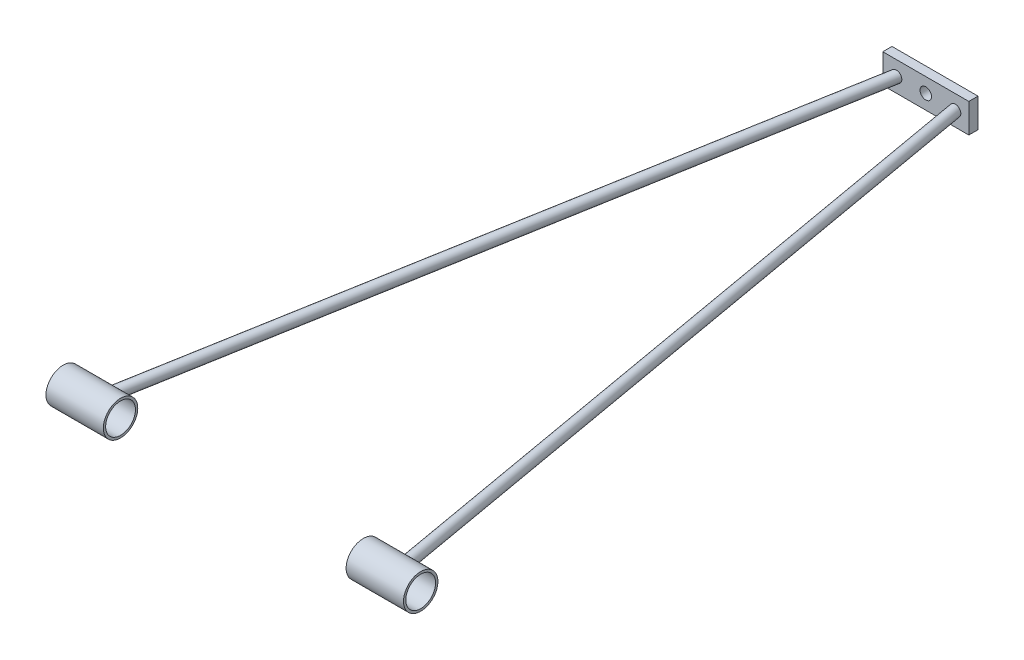
from build123d import *

# Parameters (mm, degrees)
SWEEP2_PROFILE_R        = 4.7625
SWEEP3_PROFILE_R        = 4.7625
SWEEP_THIN2_PROFILE_R   = 15
SWEEP_THIN2_PROFILE_R_2 = 13
SWEEP_THIN3_PROFILE_R   = 15
SWEEP_THIN3_PROFILE_R_2 = 13
BOSS_EXTRUDE1_DEPTH     = 12.7
SKETCH164_W             = 8
SKETCH164_H             = 25.4
CUT_EXTRUDE1_DEPTH      = 635.353542167
SKETCH165_R             = 15
CUT_EXTRUDE2_DEPTH      = 680.802036854
SKETCH166_R             = 5
CUT_EXTRUDE3_DEPTH      = 25.4


with BuildPart() as part:
    # Sweep2: sweep along a path in Sketch1
    with BuildLine(Plane(origin=(0, 0, 0), x_dir=(1, 0, 0), z_dir=(0, 1, 0))) as sweep2_path:
        Line((130.796188425, 0), (25, 600))
    # Sweep2 profile (on start of the path) → Sweep2 (sweep)
    with BuildSketch(Plane(origin=(130.796188425, 0, 0), x_dir=(-0.9848077530122079, 0, 0.17364817766693125), z_dir=(-0.17364817766693125, 0, -0.9848077530122079))):
        Circle(SWEEP2_PROFILE_R)
    sweep(path=sweep2_path.line)


with BuildPart() as body_2:
    # Sweep3: sweep along a path in Sketch78
    with BuildLine(Plane(origin=(0, 0, 0), x_dir=(1, 0, 0), z_dir=(0, 1, 0))) as sweep3_path:
        Line((-130.796188425, 0), (-25, 600))
    # Sweep3 profile (on start of the path) → Sweep3 (sweep)
    with BuildSketch(Plane(origin=(-130.796188425, 0, 0), x_dir=(-0.9848077530122079, 0, -0.17364817766693125), z_dir=(0.17364817766693125, 0, -0.9848077530122079))):
        Circle(SWEEP3_PROFILE_R)
    sweep(path=sweep3_path.line)


with BuildPart() as body_3:
    # Sweep-Thin2: sweep along a path in Sketch87
    with BuildLine(Plane(origin=(0, 0, 0), x_dir=(1, 0, 0), z_dir=(0, 1, 0))) as sweep_thin2_path:
        Line((-155.796188425, 0), (-105.796188425, 0))
    # Sweep-Thin2 profile (on start of the path) → Sweep-Thin2 (sweep)
    with BuildSketch(Plane(origin=(-155.796188425, 0, 0), x_dir=(0, 0, 1), z_dir=(1, 0, 0))):
        Circle(SWEEP_THIN2_PROFILE_R)
        Circle(SWEEP_THIN2_PROFILE_R_2, mode=Mode.SUBTRACT)
    sweep(path=sweep_thin2_path.line)


with BuildPart() as body_4:
    # Sweep-Thin3: sweep along a path in Sketch140
    with BuildLine(Plane(origin=(0, 0, 0), x_dir=(1, 0, 0), z_dir=(0, 1, 0))) as sweep_thin3_path:
        Line((105.796188425, 0), (155.796188425, 0))
    # Sweep-Thin3 profile (on start of the path) → Sweep-Thin3 (sweep)
    with BuildSketch(Plane(origin=(105.796188425, 0, 0), x_dir=(0, 0, 1), z_dir=(1, 0, 0))):
        Circle(SWEEP_THIN3_PROFILE_R)
        Circle(SWEEP_THIN3_PROFILE_R_2, mode=Mode.SUBTRACT)
    sweep(path=sweep_thin3_path.line)


with BuildPart() as body_5:
    # Sketch161 → Boss-Extrude1 (new, symmetric)
    with BuildSketch(Plane(origin=(0, 0, 0), x_dir=(1, 0, 0), z_dir=(0, 1, 0))):
        Polygon((37.5, 604), (-37.5, 604), (-37.5, 596), (-25.705307923, 596), (25.705307923, 596), (37.5, 596), align=None)
    extrude(amount=BOSS_EXTRUDE1_DEPTH, both=True)

    # Sketch166 → Cut-Extrude3 (cut)
    with BuildSketch(Plane(origin=(0, 0, -604), x_dir=(-1, 0, 0), z_dir=(0, 0, -1))):
        Circle(SKETCH166_R)
    extrude(amount=-CUT_EXTRUDE3_DEPTH, mode=Mode.SUBTRACT)


with BuildPart() as cut_extrude1_tool:
    # Sketch164 → Cut-Extrude1 (new, through all)
    with BuildSketch(Plane.ZY.offset(37.5)):
        with Locations((-600, 0)):
            Rectangle(SKETCH164_W, SKETCH164_H)
    extrude(amount=-CUT_EXTRUDE1_DEPTH)


with BuildPart() as body_2_1:
    add(body_2.part)

    # Cut-Extrude1: cut by cut_extrude1_tool
    add(cut_extrude1_tool.part, mode=Mode.SUBTRACT)


with BuildPart() as part_1:
    add(part.part)

    # Cut-Extrude1: cut by cut_extrude1_tool
    add(cut_extrude1_tool.part, mode=Mode.SUBTRACT)


with BuildPart() as cut_extrude2_tool:
    # Sketch165 → Cut-Extrude2 (new, through all)
    with BuildSketch(Plane.ZY.offset(155.796188425)):
        Circle(SKETCH165_R)
    extrude(amount=-CUT_EXTRUDE2_DEPTH)


with BuildPart() as body_2_2:
    add(body_2_1.part)

    # Cut-Extrude2: cut by cut_extrude2_tool
    add(cut_extrude2_tool.part, mode=Mode.SUBTRACT)


with BuildPart() as part_2:
    add(part_1.part)

    # Cut-Extrude2: cut by cut_extrude2_tool
    add(cut_extrude2_tool.part, mode=Mode.SUBTRACT)


solid = Compound([body_3.part, body_4.part, body_5.part, body_2_2.part, part_2.part])
